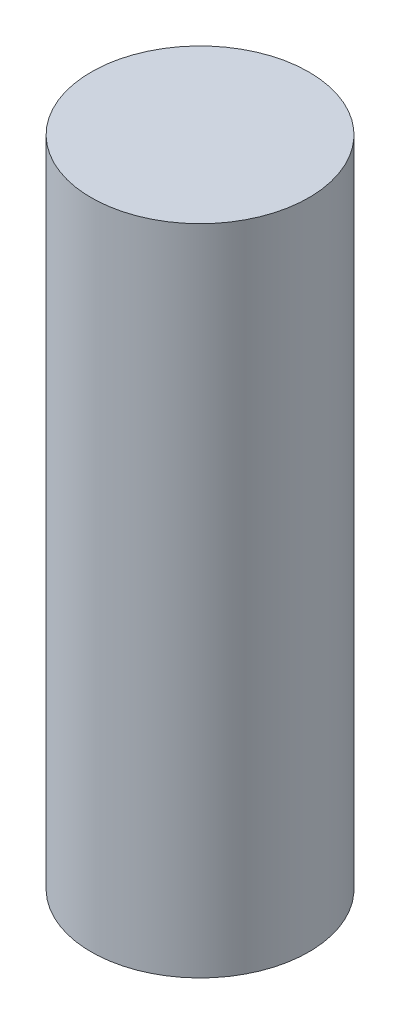
from build123d import *

# Parameters (mm, degrees)
SKETCH1_R           = 1.5875
BOSS_EXTRUDE1_DEPTH = 4.7625


with BuildPart() as part:
    # Sketch1 → Boss-Extrude1 (new, symmetric)
    with BuildSketch(Plane(origin=(0, 0, 0), x_dir=(1, 0, 0), z_dir=(0, 1, 0))):
        with Locations(Location((0, 0, 0), (0, 0, 90))):
            Circle(SKETCH1_R)
    extrude(amount=BOSS_EXTRUDE1_DEPTH, both=True)


solid = part.part
